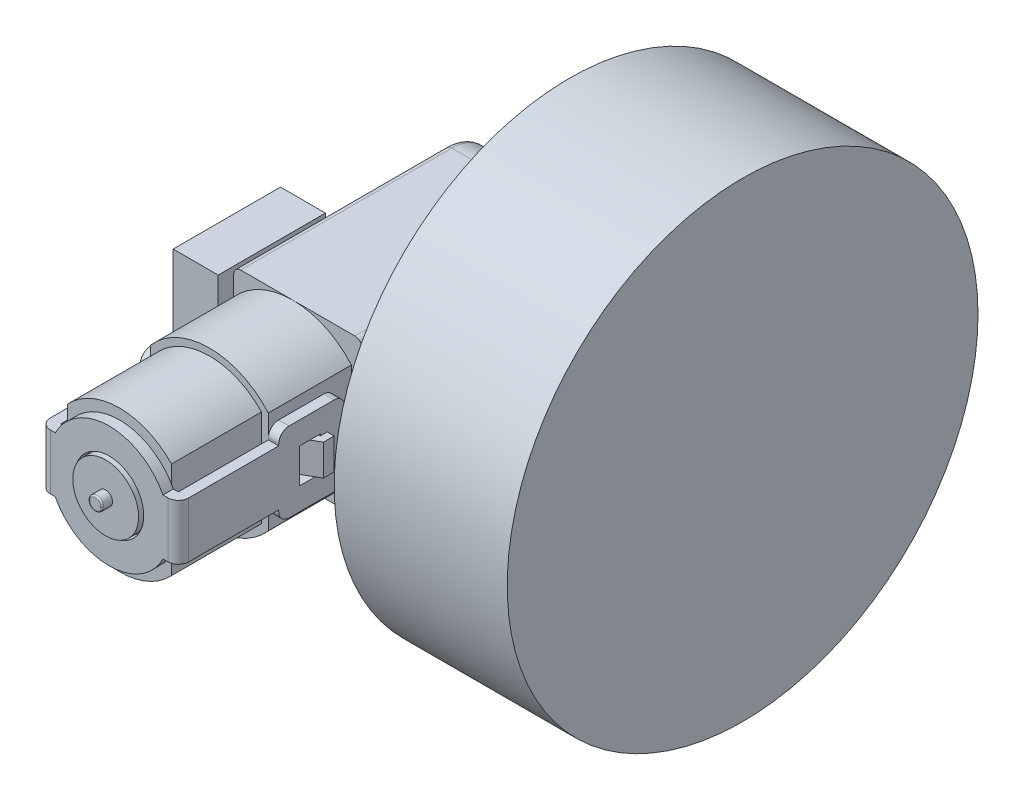
from build123d import *

# Parameters (mm, degrees)
ESBO_O1_W                 = 36.5
ESBO_O1_H                 = 22.5
RESSALTO_EXTRUS_O1_DEPTH  = 9.25
FILETE1_R                 = 6
RESSALTO_EXTRUS_O2_DEPTH  = 12
RESSALTO_EXTRUS_O3_DEPTH  = 13
ESBO_O4_R                 = 3.75
RESSALTO_EXTRUS_O4_DEPTH  = 0.5
ESBO_O5_W                 = 9.5
ESBO_O5_H                 = 11.5
RESSALTO_EXTRUS_O5_DEPTH  = 1.5
ESBO_O6_W                 = 1.5
ESBO_O6_H                 = 8
RESSALTO_EXTRUS_O6_DEPTH  = 13
ESBO_O8_R                 = 4.75
RESSALTO_EXTRUS_O7_DEPTH  = 2
ESBO_O7_R                 = 5
RESSALTO_EXTRUS_O8_DEPTH  = 1.5
ESBO_O10_W                = 1.5
ESBO_O10_H                = 8
RESSALTO_EXTRUS_O9_DEPTH  = 13
ESBO_O11_W                = 1.5
ESBO_O11_H                = 11.5
RESSALTO_EXTRUS_O10_DEPTH = 9.5
FILETE2_R                 = 1.5
ESBO_O12_W                = 3
ESBO_O12_H                = 5
CORTE_EXTRUS_O1_DEPTH     = 57.83803744
RESSALTO_EXTRUS_O11_DEPTH = 2.25
ESBO_O15_R                = 1
RESSALTO_EXTRUS_O12_DEPTH = 1.5
RESSALTO_EXTRUS_O13_DEPTH = 8
FILETE4_R                 = 1
ESBO_O17_R                = 1.5
CORTE_EXTRUS_O2_DEPTH     = 59.564601083
FILETE6_R                 = 0.2
ESBO_O20_R                = 7
RESSALTO_EXTRUS_O15_DEPTH = 5
ESBO_O21_R                = 34
RESSALTO_EXTRUS_O16_DEPTH = 25
ESBO_O23_W                = 15.5
ESBO_O23_H                = 22.5
RESSALTO_EXTRUS_O18_DEPTH = 6.5
ESBO_O24_R                = 1.25
CORTE_EXTRUS_O3_DEPTH     = 10


with BuildPart() as part:
    # Esboço1 → Ressalto-extrusão1 (new, symmetric)
    with BuildSketch(Plane(origin=(0, 0, 0), x_dir=(0, 0, -1), z_dir=(1, 0, 0))):
        with Locations((-6.75, 0)):
            Rectangle(ESBO_O1_W, ESBO_O1_H)
    extrude(amount=RESSALTO_EXTRUS_O1_DEPTH, both=True)

    # Filete1
    filete1_edges = [part.edges().sort_by_distance(p)[0] for p in [
        (0, -11.25, -11.5),
        (0, 11.25, -11.5),
    ]]
    fillet(filete1_edges, radius=FILETE1_R)

    # Esboço2 → Ressalto-extrusão2 (add)
    with BuildSketch(Plane.XY.offset(25)):
        with BuildLine():
            Line((7.75, 7.369701486), (7.75, -7.369701486))
            ThreePointArc((7.75, -7.369701486), (-0.75, -11.25), (-9.25, -7.369701486))
            Line((-9.25, -7.369701486), (-9.25, 7.369701486))
            ThreePointArc((-9.25, 7.369701486), (-0.75, 11.25), (7.75, 7.369701486))
        make_face()
    extrude(amount=RESSALTO_EXTRUS_O2_DEPTH)

    # Esboço3 → Ressalto-extrusão3 (add)
    with BuildSketch(Plane.XY.offset(37)):
        with BuildLine():
            Line((-8.25, 6.986594306), (-8.25, -6.986594306))
            ThreePointArc((-8.25, -6.986594306), (-0.75, -10.25), (6.75, -6.986594306))
            Line((6.75, -6.986594306), (6.75, 6.986594306))
            ThreePointArc((6.75, 6.986594306), (-0.75, 10.25), (-8.25, 6.986594306))
        make_face()
    extrude(amount=RESSALTO_EXTRUS_O3_DEPTH)

    # Esboço4 → Ressalto-extrusão4 (add)
    with BuildSketch(Plane(origin=(9.25, 0, 0), x_dir=(0, 0, -1), z_dir=(1, 0, 0))):
        with Locations(Location((0, 0, 0), (0, 0, 180))):
            Circle(ESBO_O4_R)
    extrude(amount=RESSALTO_EXTRUS_O4_DEPTH)

    # Esboço8 → Ressalto-extrusão7 (add)
    with BuildSketch(Plane.XY.offset(50)):
        with Locations((-0.75, 0)):
            Circle(ESBO_O8_R)
    extrude(amount=RESSALTO_EXTRUS_O7_DEPTH)

    # Esboço14 → Ressalto-extrusão11 (add, symmetric)
    with BuildSketch(Plane(origin=(0, 0, 0), x_dir=(1, 0, 0), z_dir=(0, 1, 0))):
        Polygon((7.75, -33), (10.25, -31.556624327), (10.25, -30), (9.25, -30), (9.25, -31), (7.75, -31), align=None)
    ressalto_extrus_o11 = extrude(amount=RESSALTO_EXTRUS_O11_DEPTH, both=True)

    # Espelhar6: Ressalto-extrusão11 across plane
    add(ressalto_extrus_o11.mirror(Plane(origin=(-0.75, 8.75, 51.5), x_dir=(0, 0, 1), z_dir=(-1, 0, 0))))

    # Esboço15 → Ressalto-extrusão12 (add)
    with BuildSketch(Plane.XY.offset(52)):
        with Locations((-0.75, 0)):
            Circle(ESBO_O15_R)
    extrude(amount=RESSALTO_EXTRUS_O12_DEPTH)

    # Esboço16 → Ressalto-extrusão13 (add)
    with BuildSketch(Plane(origin=(9.75, 0, 0), x_dir=(0, 0, -1), z_dir=(1, 0, 0))):
        with BuildLine():
            Line((-2.121320344, 1.75), (2.121320344, 1.75))
            ThreePointArc((2.121320344, 1.75), (2.75, 0), (2.121320344, -1.75))
            Line((2.121320344, -1.75), (-2.121320344, -1.75))
            ThreePointArc((-2.121320344, -1.75), (-2.75, 0), (-2.121320344, 1.75))
        make_face()
    extrude(amount=RESSALTO_EXTRUS_O13_DEPTH)

    # Filete4
    filete4_edges = [part.edges().sort_by_distance(p)[0] for p in [
        (-9.25, -11.25, 9.75),
        (-9.25, -9.492640687, -9.742640687),
        (-9.25, 0, -11.5),
        (-9.25, 9.492640687, -9.742640687),
        (9.25, -11.25, 9.75),
        (9.25, -9.492640687, -9.742640687),
        (9.25, 0, -11.5),
        (9.25, 9.492640687, -9.742640687),
        (-9.25, 11.25, 9.75),
        (9.25, 11.25, 9.75),
    ]]
    fillet(filete4_edges, radius=FILETE4_R)

    # Esboço17 → Corte-extrusão2 (cut, through all)
    with BuildSketch(Plane(origin=(9.25, 0, 0), x_dir=(0, 0, -1), z_dir=(1, 0, 0))):
        with Locations(Location((-19.5, 8.75, 0), (0, 0, 90))):
            Circle(ESBO_O17_R)
        with Locations(Location((-19.5, -8.75, 0), (0, 0, 270))):
            Circle(ESBO_O17_R)
    extrude(amount=-CORTE_EXTRUS_O2_DEPTH, mode=Mode.SUBTRACT)

    # Filete6
    filete6_edges = [part.edges().sort_by_distance(p)[0] for p in [
        (-1.75, 0, 53.5),
    ]]
    fillet(filete6_edges, radius=FILETE6_R)

    # Esboço20 → Ressalto-extrusão15 (add)
    with BuildSketch(Plane(origin=(9.25, 0, 0), x_dir=(0, 0, -1), z_dir=(1, 0, 0))):
        with Locations(Location((0, 0, 0), (0, 0, 180))):
            Circle(ESBO_O20_R)
    extrude(amount=RESSALTO_EXTRUS_O15_DEPTH)

    # Esboço21 → Ressalto-extrusão16 (add)
    with BuildSketch(Plane(origin=(14.25, 0, 0), x_dir=(0, 0, -1), z_dir=(1, 0, 0))):
        Circle(ESBO_O21_R)
    extrude(amount=RESSALTO_EXTRUS_O16_DEPTH)


with BuildPart() as body_2:
    # Esboço5 → Ressalto-extrusão5 (new body)
    with BuildSketch(Plane(origin=(7.75, 0, 0), x_dir=(0, 0, -1), z_dir=(1, 0, 0))):
        with Locations((-32.25, 0)):
            Rectangle(ESBO_O5_W, ESBO_O5_H)
    extrude(amount=RESSALTO_EXTRUS_O5_DEPTH)

    # Esboço6 → Ressalto-extrusão6 (add)
    with BuildSketch(Plane.XY.offset(37)):
        with Locations((8.5, 0)):
            Rectangle(ESBO_O6_W, ESBO_O6_H)
    extrude(amount=RESSALTO_EXTRUS_O6_DEPTH)

    # Esboço7 → Ressalto-extrusão8 (add)
    with BuildSketch(Plane.XY.offset(50)):
        with BuildLine():
            Line((9.25, 4), (7.032191208, 4))
            ThreePointArc((7.032191208, 4), (-0.75, 8.75), (-8.532191208, 4))
            Line((-8.532191208, 4), (-10.75, 4))
            Line((-10.75, 4), (-10.75, -4))
            Line((-10.75, -4), (-8.532191208, -4))
            ThreePointArc((-8.532191208, -4), (-0.75, -8.75), (7.032191208, -4))
            Line((7.032191208, -4), (9.25, -4))
            Line((9.25, -4), (9.25, 4))
        make_face()
        with Locations((-0.75, 0)):
            Circle(ESBO_O7_R, mode=Mode.SUBTRACT)
    extrude(amount=RESSALTO_EXTRUS_O8_DEPTH)

    # Esboço10 → Ressalto-extrusão9 (add)
    with BuildSketch(Plane(origin=(0, 0, 50), x_dir=(-1, 0, 0), z_dir=(0, 0, -1))):
        with Locations((10, 0)):
            Rectangle(ESBO_O10_W, ESBO_O10_H)
    extrude(amount=RESSALTO_EXTRUS_O9_DEPTH)

    # Esboço11 → Ressalto-extrusão10 (add)
    with BuildSketch(Plane(origin=(0, 0, 37), x_dir=(-1, 0, 0), z_dir=(0, 0, -1))):
        with Locations((10, 0)):
            Rectangle(ESBO_O11_W, ESBO_O11_H)
    extrude(amount=RESSALTO_EXTRUS_O10_DEPTH)

    # Filete2
    filete2_edges = [body_2.edges().sort_by_distance(p)[0] for p in [
        (8.5, -5.75, 37),
        (8.5, -5.75, 27.5),
        (8.5, 5.75, 27.5),
        (8.5, 5.75, 37),
        (9.25, 0, 51.5),
        (-10.75, 0, 51.5),
        (-10, -5.75, 27.5),
        (-10, -5.75, 37),
        (-10, 5.75, 37),
        (-10, 5.75, 27.5),
    ]]
    fillet(filete2_edges, radius=FILETE2_R)

    # Esboço12 → Corte-extrusão1 (cut, through all)
    with BuildSketch(Plane(origin=(9.25, 0, 0), x_dir=(0, 0, -1), z_dir=(1, 0, 0))):
        with Locations((-32.5, 0)):
            Rectangle(ESBO_O12_W, ESBO_O12_H)
    extrude(amount=-CORTE_EXTRUS_O1_DEPTH, mode=Mode.SUBTRACT)


with BuildPart() as body_3:
    # Esboço23 → Ressalto-extrusão18 (new body)
    with BuildSketch(Plane.ZY.offset(9.25)):
        with Locations((19.5, 0)):
            Rectangle(ESBO_O23_W, ESBO_O23_H)
    extrude(amount=RESSALTO_EXTRUS_O18_DEPTH)

    # Esboço24 → Corte-extrusão3 (cut)
    with BuildSketch(Plane.XZ.offset(11.25)):
        with Locations(Location((-12.5, 23.35, 0), (0, 0, 270))):
            Circle(ESBO_O24_R)
        with Locations(Location((-12.5, 15.65, 0), (0, 0, 270))):
            Circle(ESBO_O24_R)
    extrude(amount=-CORTE_EXTRUS_O3_DEPTH, mode=Mode.SUBTRACT)


solid = Compound([part.part, body_2.part, body_3.part])
